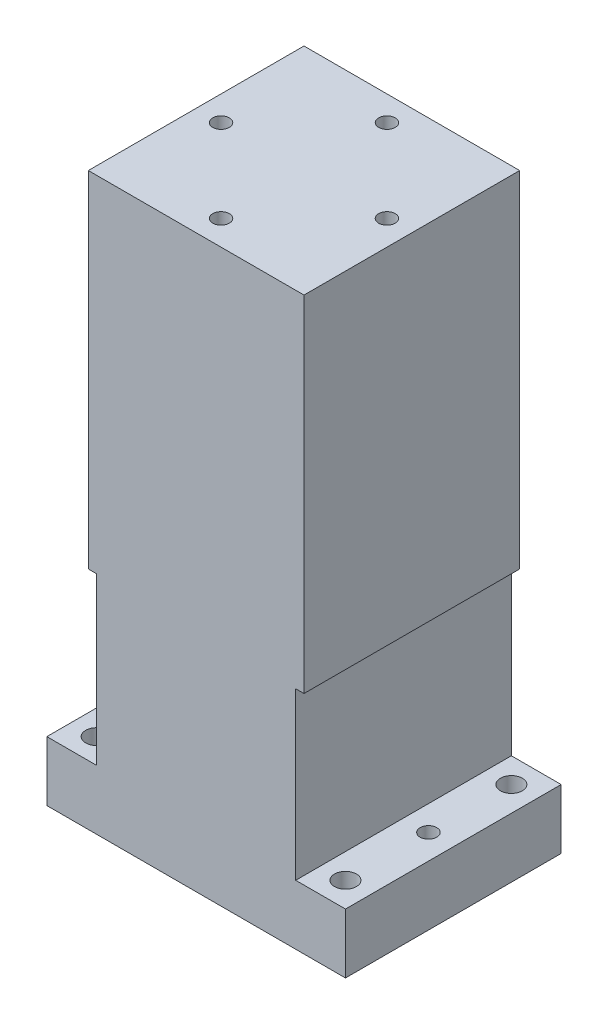
from build123d import *

# Parameters (mm, degrees)
SKIZZE1_W                            = 90
SKIZZE1_H                            = 172
AUFSATZ_LINEAR_AUSTRAGEN1_DEPTH      = 65
SKIZZE2_W                            = 15
SKIZZE2_H                            = 154
SCHNITT_LINEAR_AUSTRAGEN1_DEPTH      = 190.298705754
SKIZZE3_W                            = 65
SKIZZE3_H                            = 104
AUFSATZ_LINEAR_AUSTRAGEN2_DEPTH      = 2.5
SKIZZE4_W                            = 15
SKIZZE4_H                            = 154
SCHNITT_LINEAR_AUSTRAGEN2_DEPTH      = 190.298705754
SKIZZE5_W                            = 65
SKIZZE5_H                            = 104
AUFSATZ_LINEAR_AUSTRAGEN3_DEPTH      = 2.5
F_6_6_6_6_DURCHMESSER_BOHRUNG1_D     = 6.6
F_6_6_6_6_DURCHMESSER_BOHRUNG1_DEPTH = 172
BOHRUNG1_D                           = 5.02
BOHRUNG1_DEPTH                       = 172
F_6_6_6_6_DURCHMESSER_BOHRUNG2_D     = 6.6
BOHRUNG2_D                           = 5.02
F_5_0_5_DURCHMESSER_BOHRUNG1_D       = 5
F_5_0_5_DURCHMESSER_BOHRUNG1_DEPTH   = 17
F_5_0_5_DURCHMESSER_BOHRUNG1_TIP     = 1.502151548


with BuildPart() as part:
    # Skizze1 → Aufsatz-Linear austragen1 (new body)
    with BuildSketch(Plane(origin=(0, 0, -32.5), x_dir=(-1, 0, 0), z_dir=(0, 0, -1))):
        with Locations((0, 86)):
            Rectangle(SKIZZE1_W, SKIZZE1_H)
    extrude(amount=-AUFSATZ_LINEAR_AUSTRAGEN1_DEPTH)

    # Skizze2 → Schnitt-Linear austragen1 (cut, through all)
    with BuildSketch(Plane.XY.offset(32.5)):
        with Locations((-37.5, 95)):
            Rectangle(SKIZZE2_W, SKIZZE2_H)
    extrude(amount=-SCHNITT_LINEAR_AUSTRAGEN1_DEPTH, mode=Mode.SUBTRACT)

    # Skizze3 → Aufsatz-Linear austragen2 (add)
    with BuildSketch(Plane.ZY.offset(30)):
        with Locations((0, 120)):
            Rectangle(SKIZZE3_W, SKIZZE3_H)
    extrude(amount=AUFSATZ_LINEAR_AUSTRAGEN2_DEPTH)

    # Skizze4 → Schnitt-Linear austragen2 (cut, through all)
    with BuildSketch(Plane.XY.offset(32.5)):
        with Locations((37.5, 95)):
            Rectangle(SKIZZE4_W, SKIZZE4_H)
    extrude(amount=-SCHNITT_LINEAR_AUSTRAGEN2_DEPTH, mode=Mode.SUBTRACT)

    # Skizze5 → Aufsatz-Linear austragen3 (add)
    with BuildSketch(Plane(origin=(30, 0, 0), x_dir=(0, 0, -1), z_dir=(1, 0, 0))):
        with Locations((0, 120)):
            Rectangle(SKIZZE5_W, SKIZZE5_H)
    extrude(amount=AUFSATZ_LINEAR_AUSTRAGEN3_DEPTH)

    # Ø6.6 (6.6) Durchmesser Bohrung1
    with Locations(Plane(origin=(0, 0, 0), x_dir=(-1, 0, 0), z_dir=(0, -1, 0))):
        with Locations((37.5, -25), (37.5, 25)):
            Hole(F_6_6_6_6_DURCHMESSER_BOHRUNG1_D / 2, depth=F_6_6_6_6_DURCHMESSER_BOHRUNG1_DEPTH)

    # Bohrung1
    with Locations(Plane(origin=(0, 0, 0), x_dir=(-1, 0, 0), z_dir=(0, -1, 0))):
        with Locations((37.5, 0)):
            Hole(BOHRUNG1_D / 2, depth=BOHRUNG1_DEPTH)

    # Ø6.6 (6.6) Durchmesser Bohrung2 (through all)
    with Locations(Plane(origin=(0, 18, 0), x_dir=(1, 0, 0), z_dir=(0, 1, 0))):
        with Locations((37.5, 25), (37.5, -25)):
            Hole(F_6_6_6_6_DURCHMESSER_BOHRUNG2_D / 2)

    # Bohrung2 (through all)
    with Locations(Plane(origin=(0, 18, 0), x_dir=(1, 0, 0), z_dir=(0, 1, 0))):
        with Locations((37.5, 0)):
            Hole(BOHRUNG2_D / 2)

    # Ø5.0 (5) Durchmesser Bohrung1
    with Locations(Plane(origin=(0, 172, 0), x_dir=(1, 0, 0), z_dir=(0, 1, 0))):
        with Locations((-25, 0), (25, 0), (0, 25), (0, -25)):
            Hole(F_5_0_5_DURCHMESSER_BOHRUNG1_D / 2, depth=F_5_0_5_DURCHMESSER_BOHRUNG1_DEPTH)
            with Locations((0, 0, -(F_5_0_5_DURCHMESSER_BOHRUNG1_DEPTH + F_5_0_5_DURCHMESSER_BOHRUNG1_TIP / 2))):  # 118° drill point
                Cone(0, F_5_0_5_DURCHMESSER_BOHRUNG1_D / 2, F_5_0_5_DURCHMESSER_BOHRUNG1_TIP, mode=Mode.SUBTRACT)


solid = part.part
